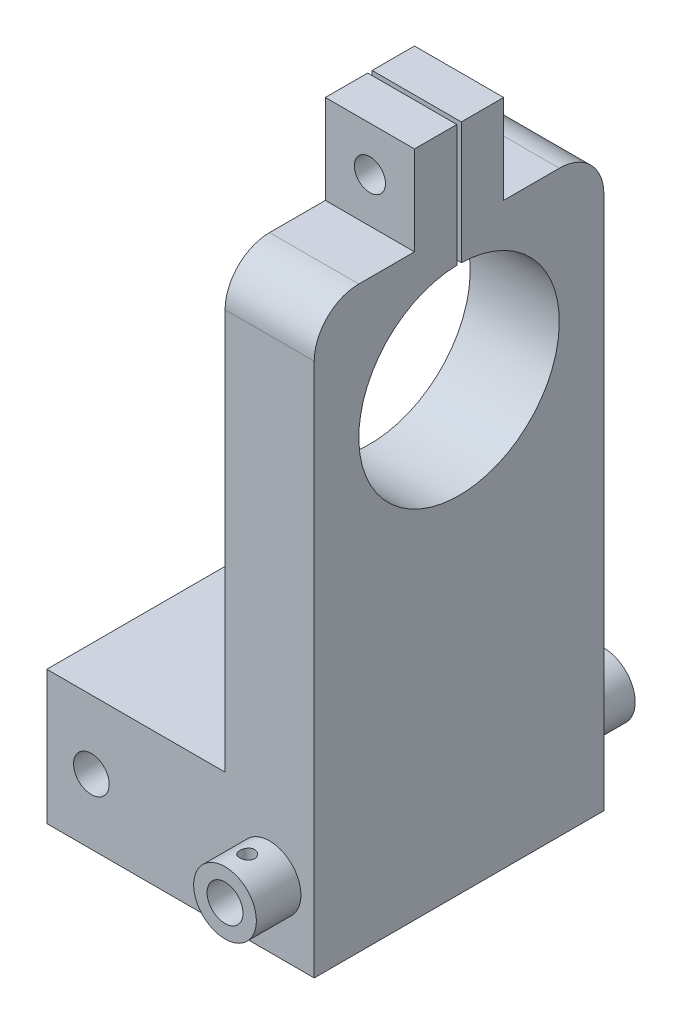
from build123d import *

# Parameters (mm, degrees)
CROQUIS1_R                                     = 22.5
SALIENTE_EXTRUIR1_DEPTH                        = 20
CROQUIS2_W                                     = 65
CROQUIS2_H                                     = 30
SALIENTE_EXTRUIR2_DEPTH                        = 40
CROQUIS4_W                                     = 1
CROQUIS4_H                                     = 60
CORTAR_EXTRUIR1_DEPTH                          = 40
TALADRO_DE_MARGEN_PARA_M61_D                   = 7
CROQUIS6_R                                     = 4
CORTAR_EXTRUIR2_DEPTH                          = 126.797456254
SALIENTE_EXTRUIR3_DEPTH                        = 10
SALIENTE_EXTRUIR3_DEPTH_BACK                   = 75
CROQUIS7_R                                     = 7.032700754
CROQUIS7_R_2                                   = 4.032700754
PERFORADOR_PARA_ROSCAR_PARA_MACHO_DE_ROS_D     = 3.3
PERFORADOR_PARA_ROSCAR_PARA_MACHO_DE_ROS_DEPTH = 5
PERFORADOR_PARA_ROSCAR_PARA_MACHO_DE_ROS_TIP   = 0.991420021
PERFORADOR_PARA_ROSCAR_PARA_MACHO_DE_2_D       = 3.3
PERFORADOR_PARA_ROSCAR_PARA_MACHO_DE_2_DEPTH   = 5
PERFORADOR_PARA_ROSCAR_PARA_MACHO_DE_2_TIP     = 0.991420021


with BuildPart() as part:
    # Croquis1 → Saliente-Extruir1 (new body)
    with BuildSketch(Plane(origin=(0, 0, 0), x_dir=(0, 0, -1), z_dir=(1, 0, 0))):
        with BuildLine():
            Line((-32.5, 0), (-32.5, -100))
            Line((-32.5, -100), (32.5, -100))
            Line((32.5, -100), (32.5, 0))
            Line((32.5, 0), (32.5, 19.863502686))
            ThreePointArc((32.5, 19.863502686), (29.571067812, 26.934570498), (22.5, 29.863502686))
            Line((22.5, 29.863502686), (10, 29.863502686))
            Line((10, 29.863502686), (10, 49.863502686))
            Line((10, 49.863502686), (-10, 49.863502686))
            Line((-10, 49.863502686), (-10, 29.863502686))
            Line((-10, 29.863502686), (-22.5, 29.863502686))
            ThreePointArc((-22.5, 29.863502686), (-29.571067812, 26.934570498), (-32.5, 19.863502686))
            Line((-32.5, 19.863502686), (-32.5, 0))
        make_face()
        Circle(CROQUIS1_R, mode=Mode.SUBTRACT)
    extrude(amount=SALIENTE_EXTRUIR1_DEPTH)

    # Croquis2 → Saliente-Extruir2 (add)
    with BuildSketch(Plane.ZY):
        with Locations((0, -85)):
            Rectangle(CROQUIS2_W, CROQUIS2_H)
    extrude(amount=SALIENTE_EXTRUIR2_DEPTH)

    # Croquis4 → Cortar-Extruir1 (cut)
    with BuildSketch(Plane.ZY):
        with Locations((0, 26.927828438)):
            Rectangle(CROQUIS4_W, CROQUIS4_H)
    extrude(amount=-CORTAR_EXTRUIR1_DEPTH, mode=Mode.SUBTRACT)

    # Taladro de margen para M61 (through all)
    with Locations(Plane(origin=(10, 39.863502686, -10), x_dir=(0, -1, 0), z_dir=(0, 0, -1))):
        with Locations((0, 0)):
            Hole(TALADRO_DE_MARGEN_PARA_M61_D / 2)

    # Croquis6 → Cortar-Extruir2 (cut, through all)
    with BuildSketch(Plane(origin=(0, 0, -32.5), x_dir=(-1, 0, 0), z_dir=(0, 0, -1))):
        with Locations((30, -85.367078143)):
            Circle(CROQUIS6_R)
        with Locations(Location((-10, -85.367078143, 0), (0, 0, 180))):
            Circle(CROQUIS6_R)
    extrude(amount=-CORTAR_EXTRUIR2_DEPTH, mode=Mode.SUBTRACT)

    # Croquis7 → Saliente-Extruir3 (add, two sides: drawn at the far end of the back side and taken through both)
    with BuildSketch(Plane.XY.offset(32.5).offset(-SALIENTE_EXTRUIR3_DEPTH_BACK)):
        with Locations((9.986743511, -85.396971367)):
            Circle(CROQUIS7_R)
        with Locations((9.986743511, -85.396971367)):
            Circle(CROQUIS7_R_2, mode=Mode.SUBTRACT)
    extrude(amount=SALIENTE_EXTRUIR3_DEPTH + SALIENTE_EXTRUIR3_DEPTH_BACK)

    # Perforador para roscar para macho de roscar para M4x0.71
    with Locations(Plane(origin=(9.940279275, -78.364424106, 37.5), x_dir=(0.999978174306, 0.006606883628, 0), z_dir=(-0.006606883628, 0.999978174306, 0))):
        with Locations((0, 0)):
            Hole(PERFORADOR_PARA_ROSCAR_PARA_MACHO_DE_ROS_D / 2, depth=PERFORADOR_PARA_ROSCAR_PARA_MACHO_DE_ROS_DEPTH)
            with Locations((0, 0, -(PERFORADOR_PARA_ROSCAR_PARA_MACHO_DE_ROS_DEPTH + PERFORADOR_PARA_ROSCAR_PARA_MACHO_DE_ROS_TIP / 2))):  # 118° drill point
                Cone(0, PERFORADOR_PARA_ROSCAR_PARA_MACHO_DE_ROS_D / 2, PERFORADOR_PARA_ROSCAR_PARA_MACHO_DE_ROS_TIP, mode=Mode.SUBTRACT)

    # Perforador para roscar para macho de 2
    with Locations(Plane(origin=(10.118803472, -78.365510632, -37.5), x_dir=(0.999823677927, -0.018777993951, 0), z_dir=(0.018777993951, 0.999823677927, 0))):
        with Locations((0, 0)):
            Hole(PERFORADOR_PARA_ROSCAR_PARA_MACHO_DE_2_D / 2, depth=PERFORADOR_PARA_ROSCAR_PARA_MACHO_DE_2_DEPTH)
            with Locations((0, 0, -(PERFORADOR_PARA_ROSCAR_PARA_MACHO_DE_2_DEPTH + PERFORADOR_PARA_ROSCAR_PARA_MACHO_DE_2_TIP / 2))):  # 118° drill point
                Cone(0, PERFORADOR_PARA_ROSCAR_PARA_MACHO_DE_2_D / 2, PERFORADOR_PARA_ROSCAR_PARA_MACHO_DE_2_TIP, mode=Mode.SUBTRACT)


solid = part.part
